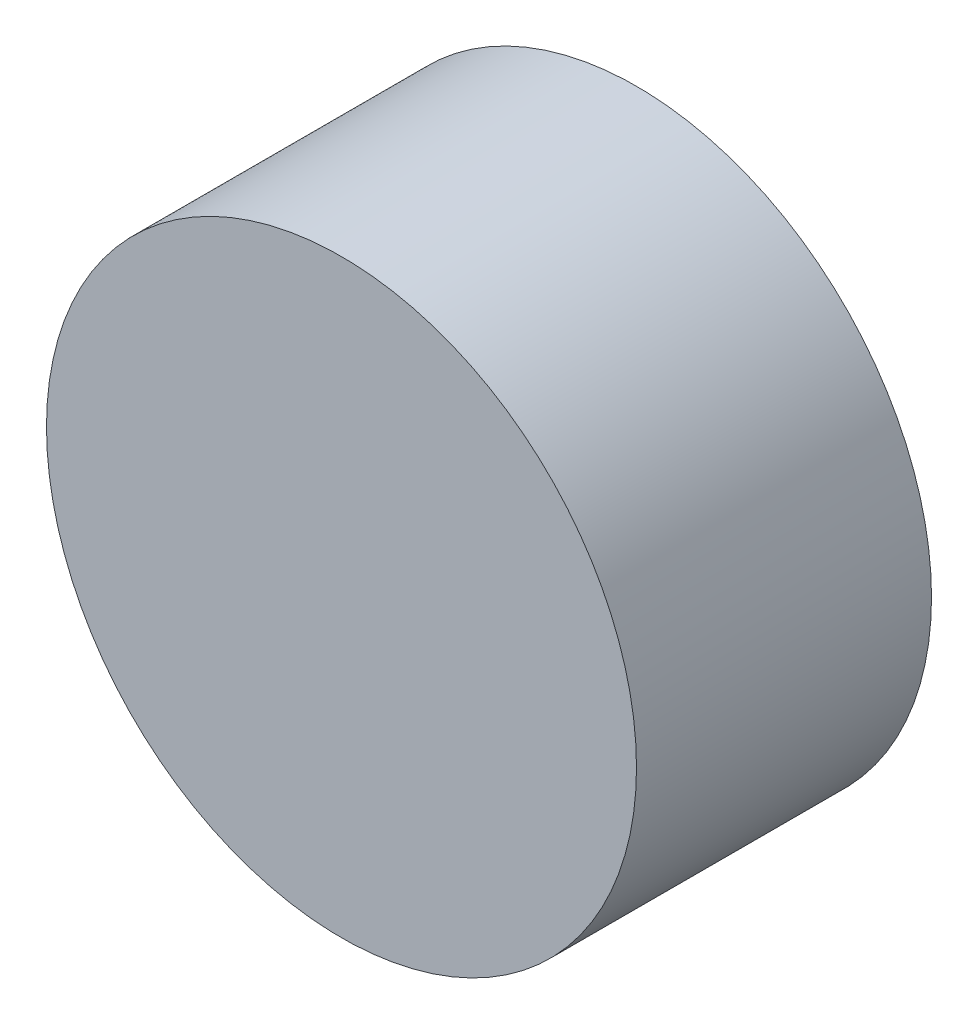
from build123d import *

# Parameters (mm, degrees)
SKETCH1_R                = 100
BOSS_EXTRUDE1_DEPTH      = 100
BOSS_EXTRUDE2_DEPTH      = 20
BOSS_EXTRUDE2_DEPTH_BACK = 20
SKETCH2_W                = 25
SKETCH2_H                = 10
SKETCH4_R                = 5
CUT_EXTRUDE1_DEPTH       = 20


with BuildPart() as part:
    # Sketch1 → Boss-Extrude1 (new body)
    with BuildSketch(Plane.XY):
        Circle(SKETCH1_R)
    extrude(amount=BOSS_EXTRUDE1_DEPTH)

    # Sketch2 → Boss-Extrude2 (add, two sides: drawn at the far end of the back side and taken through both)
    with BuildSketch(Plane(origin=(0, 0, 0), x_dir=(-1, 0, 0), z_dir=(0, 0, -1)).offset(-BOSS_EXTRUDE2_DEPTH_BACK)):
        Rectangle(SKETCH2_W, SKETCH2_H)
    extrude(amount=BOSS_EXTRUDE2_DEPTH + BOSS_EXTRUDE2_DEPTH_BACK)

    # Sketch4 → Cut-Extrude1 (cut)
    with BuildSketch(Plane.XZ.offset(5)):
        with Locations(Location((0, -10, 0), (0, 0, 270))):
            Circle(SKETCH4_R)
    extrude(amount=-CUT_EXTRUDE1_DEPTH, mode=Mode.SUBTRACT)


solid = part.part
